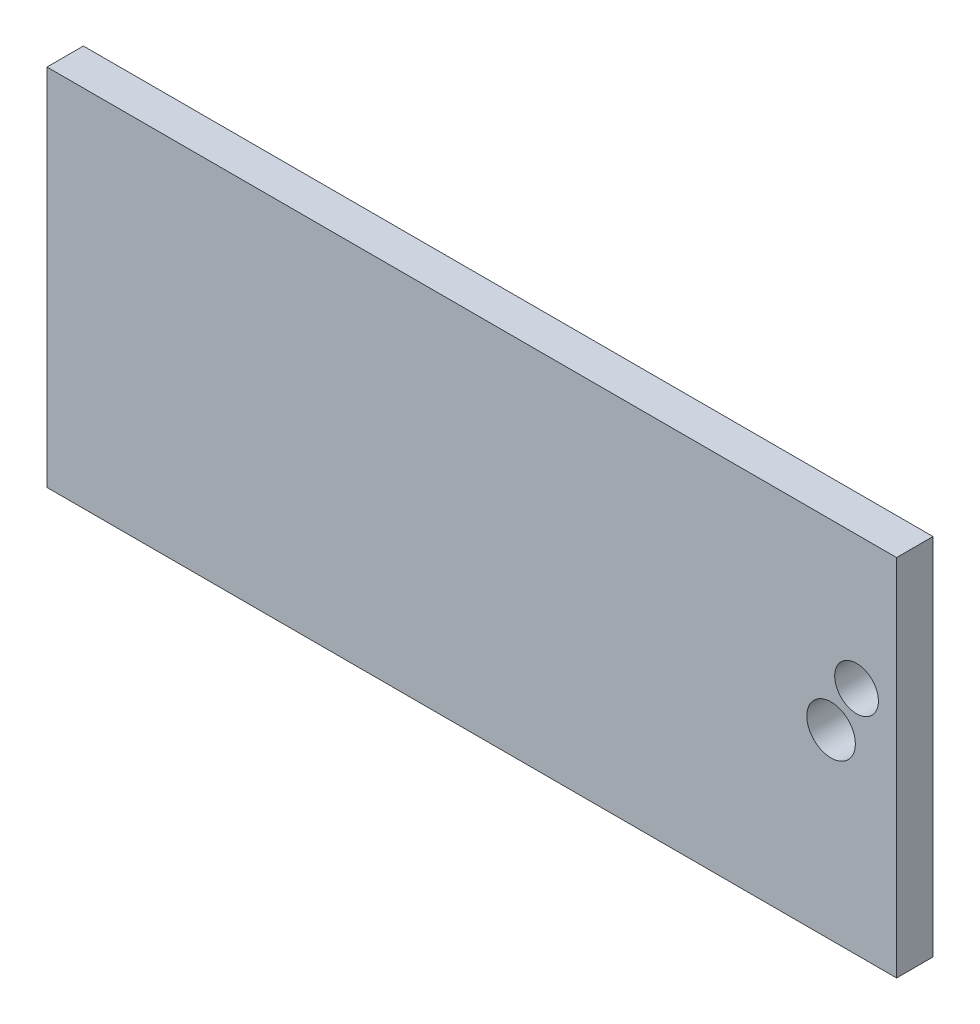
from build123d import *

# Parameters (mm, degrees)
ESQUISSE1_W             = 350
ESQUISSE1_H             = 150
BOSS_EXTRU_1_DEPTH      = 15
ESQUISSE2_R             = 10
ENL_V_MAT_EXTRU_2_DEPTH = 382.083980246
ESQUISSE3_R             = 9
ENL_V_MAT_EXTRU_3_DEPTH = 20


with BuildPart() as part:
    # Esquisse1 → Boss.-Extru.1 (new body)
    with BuildSketch(Plane.XY):
        with Locations((175, -75)):
            Rectangle(ESQUISSE1_W, ESQUISSE1_H)
    extrude(amount=BOSS_EXTRU_1_DEPTH)

    # Esquisse2 → Enlèv. mat.-Extru.2 (cut, through all)
    with BuildSketch(Plane(origin=(0, 0, 0), x_dir=(-1, 0, 0), z_dir=(0, 0, -1))):
        with Locations((-323, -75)):
            Circle(ESQUISSE2_R)
    extrude(amount=-ENL_V_MAT_EXTRU_2_DEPTH, mode=Mode.SUBTRACT)

    # Esquisse3 → Enlèv. mat.-Extru.3 (cut)
    with BuildSketch(Plane.XY.offset(15)):
        with Locations((333.5, -54.976135627)):
            Circle(ESQUISSE3_R)
    extrude(amount=-ENL_V_MAT_EXTRU_3_DEPTH, mode=Mode.SUBTRACT)


solid = part.part
